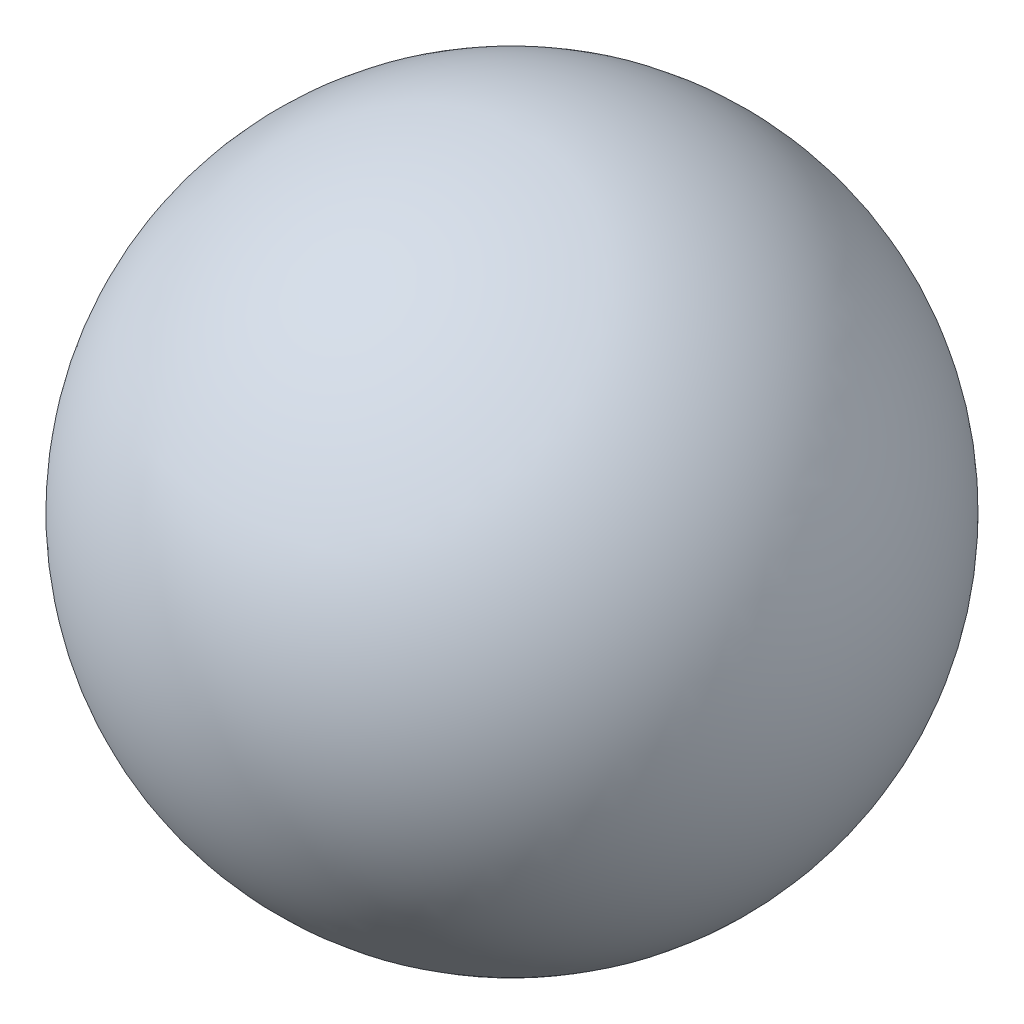
from build123d import *


with BuildPart() as part:
    # Esquisse1 → Révolution4 (revolve)
    with BuildSketch(Plane.XY):
        with BuildLine():
            Line((0, 4), (0, 5))
            ThreePointArc((0, 5), (4.942088629, 0.758788496), (1.5, -4.769696007))
            Line((1.5, -4.769696007), (1.5, -3.708099244))
            ThreePointArc((1.5, -3.708099244), (3.92634671, 0.76406905), (0, 4))
        make_face()
    revolve(axis=Axis((0, 0, 0), (0, 1, 0)))


solid = part.part
